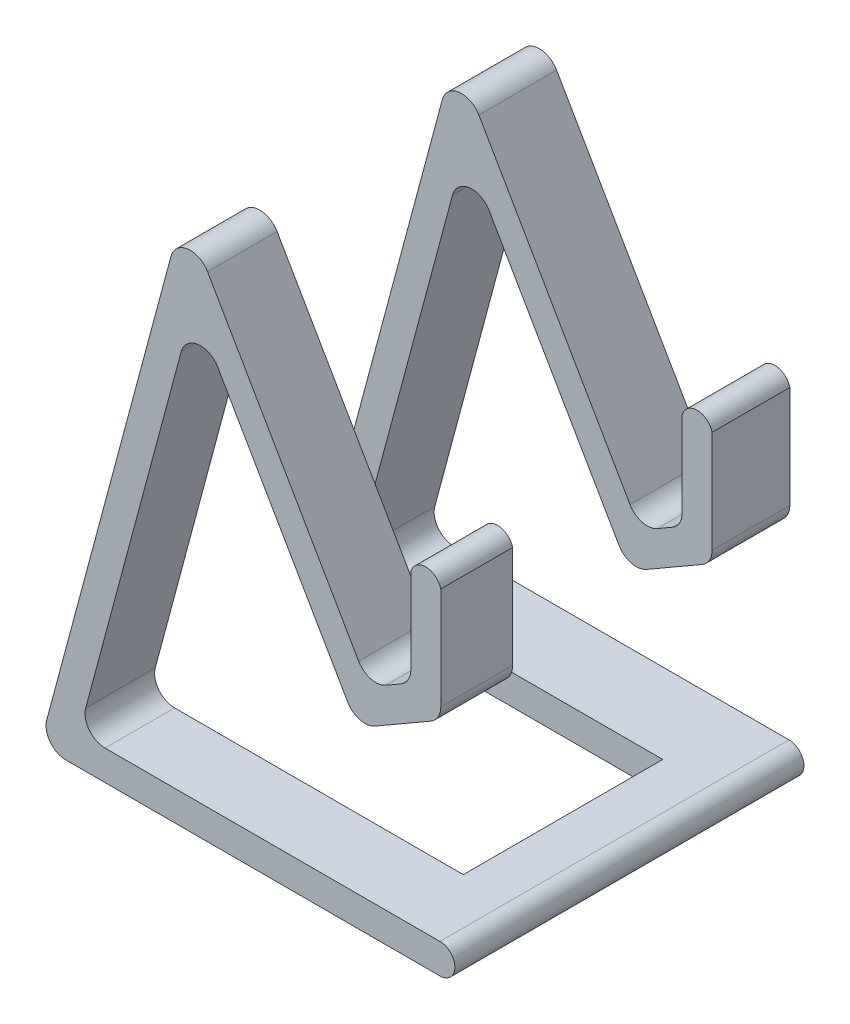
from build123d import *

# Parameters (mm, degrees)
BOSS_EXTRUDE1_DEPTH     = 70
CUT_EXTRUDE3_DEPTH      = 145.019444896
CUT_EXTRUDE3_DEPTH_BACK = 145.019444896
SKETCH2_W               = 40
SKETCH2_H               = 90
CUT_EXTRUDE4_DEPTH      = 145.019444896
CUT_EXTRUDE4_DEPTH_BACK = 145.019444896
SKETCH3_W               = 74.200339426
SKETCH3_H               = 40


with BuildPart() as part:
    # Sketch1 → Boss-Extrude1 (new body)
    with BuildSketch(Plane.XY):
        with BuildLine():
            Line((0, 3), (-67.156880159, 3))
            ThreePointArc((-67.156880159, 3), (-70.33029352, 4.564954284), (-71.020583464, 8.03527618))
            Line((-71.020583464, 8.03527618), (-51.873686922, 79.492466883))
            ThreePointArc((-51.873686922, 79.492466883), (-48.532088385, 82.422970148), (-44.545882001, 80.457190703))
            Line((-44.545882001, 80.457190703), (-18.49562947, 35.336829768))
            ThreePointArc((-18.49562947, 35.336829768), (-16.066804035, 33.473126463), (-13.031527854, 33.872728153))
            Line((-13.031527854, 33.872728153), (-1.828193725, 40.340976128))
            ThreePointArc((-1.828193725, 40.340976128), (-0.36409211, 41.805077743), (0.171806275, 43.805077743))
            Line((0.171806275, 43.805077743), (0.171806275, 64.29182561))
            ThreePointArc((0.171806275, 64.29182561), (-2.828193725, 66.625142685), (-5.828193725, 64.29182561))
            Line((-5.828193725, 64.29182561), (-5.828193725, 47.269179358))
            ThreePointArc((-5.828193725, 47.269179358), (-6.36409211, 45.269179358), (-7.828193725, 43.805077743))
            Line((-7.828193725, 43.805077743), (-10.835375432, 42.068880575))
            ThreePointArc((-10.835375432, 42.068880575), (-13.870651612, 41.669278885), (-16.299477047, 43.53298219))
            Line((-16.299477047, 43.53298219), (-46.592370266, 96.001812354))
            ThreePointArc((-46.592370266, 96.001812354), (-50.57857665, 97.967591799), (-53.920175186, 95.037088534))
            Line((-53.920175186, 95.037088534), (-78.839935701, 2.03527618))
            ThreePointArc((-78.839935701, 2.03527618), (-78.149645757, -1.435045716), (-74.976232396, -3))
            Line((-74.976232396, -3), (0, -3))
            ThreePointArc((0, -3), (3, 0), (0, 3))
        make_face()
    extrude(amount=BOSS_EXTRUDE1_DEPTH)

    # Sketch2 → Cut-Extrude3 (cut, two sides: drawn at the far end of the back side and taken through both)
    with BuildSketch(Plane(origin=(0, 0, 0), x_dir=(0, 0, -1), z_dir=(1, 0, 0)).offset(-CUT_EXTRUDE3_DEPTH_BACK)):
        with Locations((-35.588760561, 57.237154529)):
            Rectangle(SKETCH2_W, SKETCH2_H)
    extrude(amount=CUT_EXTRUDE3_DEPTH + CUT_EXTRUDE3_DEPTH_BACK, mode=Mode.SUBTRACT)

    # Sketch3 → Cut-Extrude4 (cut, two sides: drawn at the far end of the back side and taken through both)
    with BuildSketch(Plane(origin=(0, 0, 0), x_dir=(1, 0, 0), z_dir=(0, 1, 0)).offset(-CUT_EXTRUDE4_DEPTH_BACK)):
        with Locations((-46.354271726, -36.051698815)):
            Rectangle(SKETCH3_W, SKETCH3_H)
    extrude(amount=CUT_EXTRUDE4_DEPTH + CUT_EXTRUDE4_DEPTH_BACK, mode=Mode.SUBTRACT)


solid = part.part
